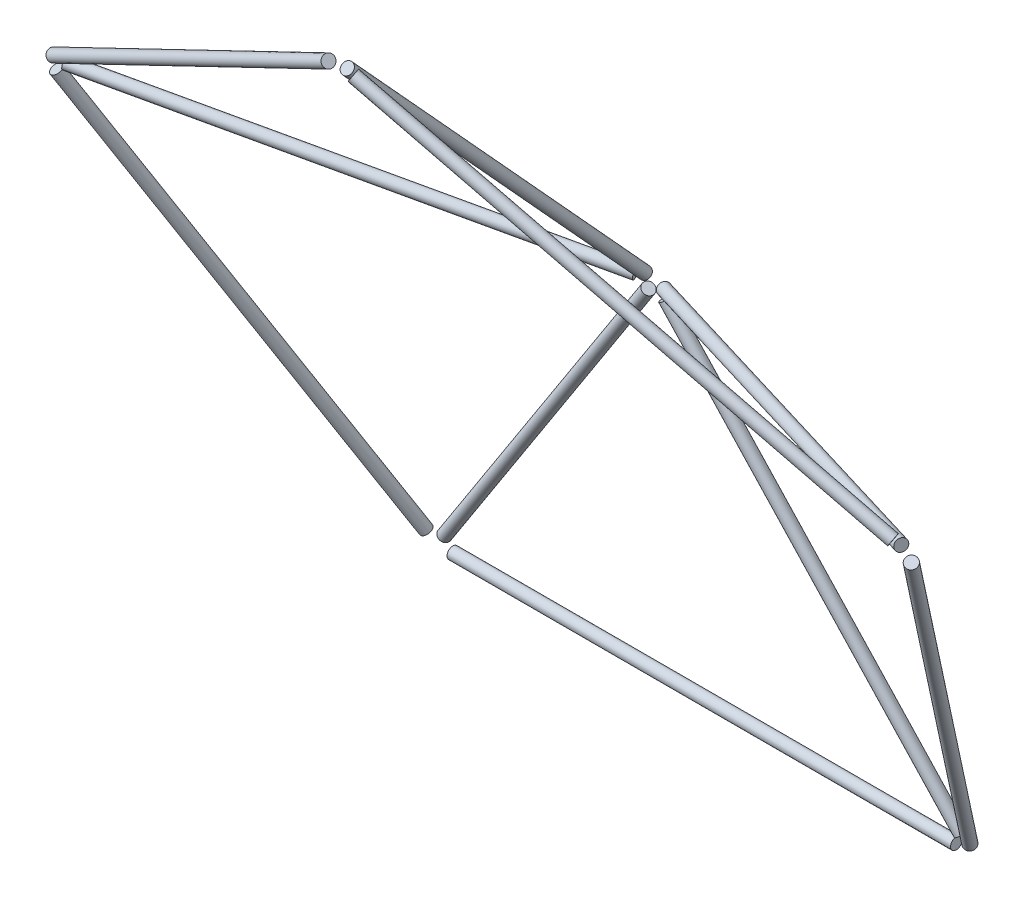
from build123d import *

# Parameters (mm, degrees)
SKETCH20_R        = 1.5
SKETCH21_R        = 1.5
CIRPATTERN7_COUNT = 5
CIRPATTERN8_COUNT = 5


with BuildPart() as part:
    # Sweep4: sweep along a path in Sketch16
    with BuildLine(Plane(origin=(66.892069837, 70.138107462, -188.876148446), x_dir=(-0.9490605003608429, 0.10968961318168566, -0.2953850968056427), z_dir=(0.3150939013291542, 0.3303843036360469, -0.8896977269028498))) as sweep4_path:
        Line((68.099364678, 21.05930201), (-0.395234209, -71.280161761))
    # Sketch20 → Sweep4 (sweep)
    with BuildSketch(Plane(origin=(2.261652721, 97.349964421, -201.660580189), x_dir=(-0.8248078173251137, -0.5609339440894788, -0.07102939425057496), z_dir=(0.5654131803198278, -0.8182736416337228, -0.10361555350478845))):
        Circle(SKETCH20_R)
    sweep(path=sweep4_path.line)


with BuildPart() as body_2:
    # Sweep5: sweep along a path in Sketch6
    with BuildLine(Plane(origin=(0, 85.595086467, -171.190172933), x_dir=(-1, 0, 0), z_dir=(0, 0.44721359549995754, -0.8944271909999162))) as sweep5_path:
        Line((-111.263932023, 32.749239761), (-70.764891712, -91.893989874))
    # Sketch21 → Sweep5 (sweep)
    with BuildSketch(Plane(origin=(70.764891712, 3.402603233, -212.28641455), x_dir=(-0.9510565162951541, 0.2763932022500199, 0.1381966011250097), z_dir=(-0.309016994374946, -0.8506508083520407, -0.42532540417601955))):
        Circle(SKETCH21_R)
    sweep(path=sweep5_path.line)


with BuildPart() as cirpattern7_1:
    # CirPattern7: pattern copy
    add(part.part.rotate(Axis((0, 85.595086467, -171.190172933), (2.4466476304515184e-15, 0.44721359549995693, -0.8944271909999164)), 1 * 360 / CIRPATTERN7_COUNT))


with BuildPart() as cirpattern7_2:
    # CirPattern7: pattern copy
    add(part.part.rotate(Axis((0, 85.595086467, -171.190172933), (2.4466476304515184e-15, 0.44721359549995693, -0.8944271909999164)), 2 * 360 / CIRPATTERN7_COUNT))


with BuildPart() as cirpattern7_3:
    # CirPattern7: pattern copy
    add(part.part.rotate(Axis((0, 85.595086467, -171.190172933), (2.4466476304515184e-15, 0.44721359549995693, -0.8944271909999164)), 3 * 360 / CIRPATTERN7_COUNT))


with BuildPart() as cirpattern7_4:
    # CirPattern7: pattern copy
    add(part.part.rotate(Axis((0, 85.595086467, -171.190172933), (2.4466476304515184e-15, 0.44721359549995693, -0.8944271909999164)), 4 * 360 / CIRPATTERN7_COUNT))


with BuildPart() as cirpattern8_1:
    # CirPattern8: pattern copy
    add(body_2.part.rotate(Axis((0, 0, 0), (2.0720596882994017e-15, 0.44721359549995665, -0.8944271909999165)), 1 * 360 / CIRPATTERN8_COUNT))


with BuildPart() as cirpattern8_2:
    # CirPattern8: pattern copy
    add(body_2.part.rotate(Axis((0, 0, 0), (2.0720596882994017e-15, 0.44721359549995665, -0.8944271909999165)), 2 * 360 / CIRPATTERN8_COUNT))


with BuildPart() as cirpattern8_3:
    # CirPattern8: pattern copy
    add(body_2.part.rotate(Axis((0, 0, 0), (2.0720596882994017e-15, 0.44721359549995665, -0.8944271909999165)), 3 * 360 / CIRPATTERN8_COUNT))


with BuildPart() as cirpattern8_4:
    # CirPattern8: pattern copy
    add(body_2.part.rotate(Axis((0, 0, 0), (2.0720596882994017e-15, 0.44721359549995665, -0.8944271909999165)), 4 * 360 / CIRPATTERN8_COUNT))


solid = Compound([part.part, body_2.part, cirpattern7_1.part, cirpattern7_2.part, cirpattern7_3.part, cirpattern7_4.part, cirpattern8_1.part, cirpattern8_2.part, cirpattern8_3.part, cirpattern8_4.part])
